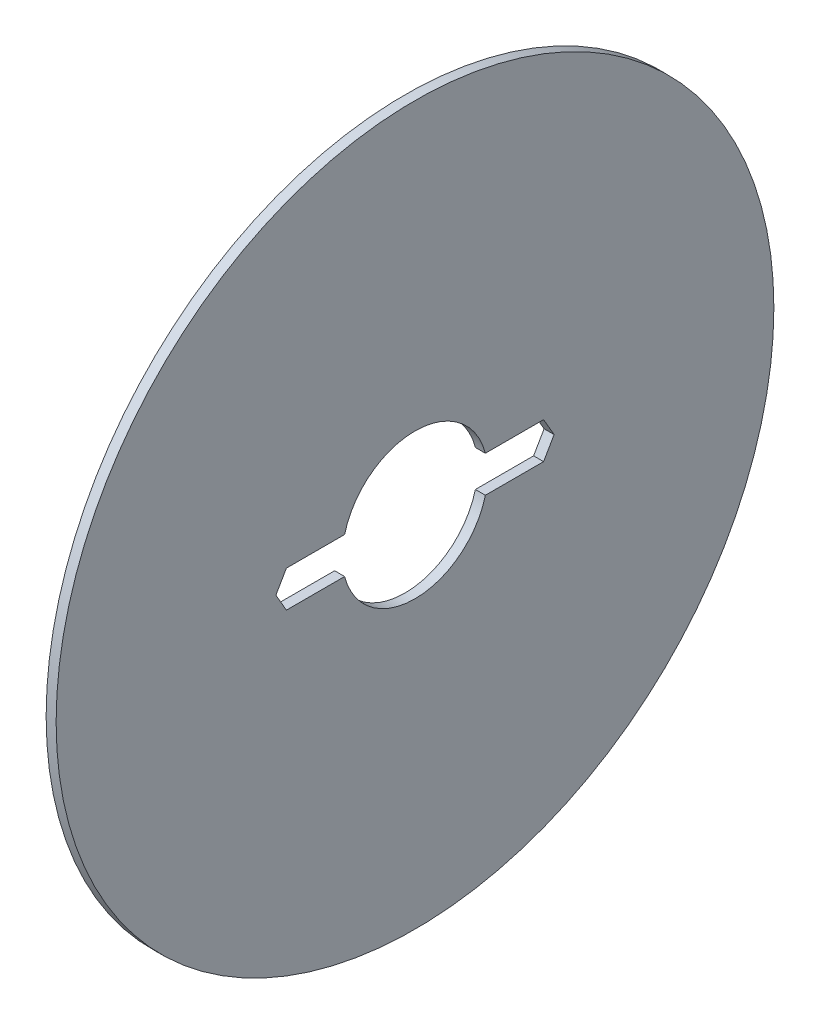
from build123d import *

# Parameters (mm, degrees)
SKETCH1_R           = 19.75
BOSS_EXTRUDE1_DEPTH = 0.55


with BuildPart() as part:
    # Sketch1 → Boss-Extrude1 (new body)
    with BuildSketch(Plane(origin=(0, 0, 0), x_dir=(0, 0, -1), z_dir=(1, 0, 0))):
        Circle(SKETCH1_R)
        with BuildLine():
            Line((5.922649731, 1), (3.872983346, 1))
            ThreePointArc((3.872983346, 1), (0, 4), (-3.872983346, 1))
            Line((-3.872983346, 1), (-5.922649731, 1))
            Line((-5.922649731, 1), (-7.077350269, 1))
            Line((-7.077350269, 1), (-7.654700538, 0))
            Line((-7.654700538, 0), (-7.077350269, -1))
            Line((-7.077350269, -1), (-5.922649731, -1))
            Line((-5.922649731, -1), (-3.872983346, -1))
            ThreePointArc((-3.872983346, -1), (0, -4), (3.872983346, -1))
            Line((3.872983346, -1), (5.922649731, -1))
            Line((5.922649731, -1), (6.5, -1))
            Line((6.5, -1), (7.077350269, -1))
            Line((7.077350269, -1), (7.654700538, 0))
            Line((7.654700538, 0), (7.077350269, 1))
            Line((7.077350269, 1), (6.5, 1))
            Line((6.5, 1), (5.922649731, 1))
        make_face(mode=Mode.SUBTRACT)
    extrude(amount=BOSS_EXTRUDE1_DEPTH)


solid = part.part
